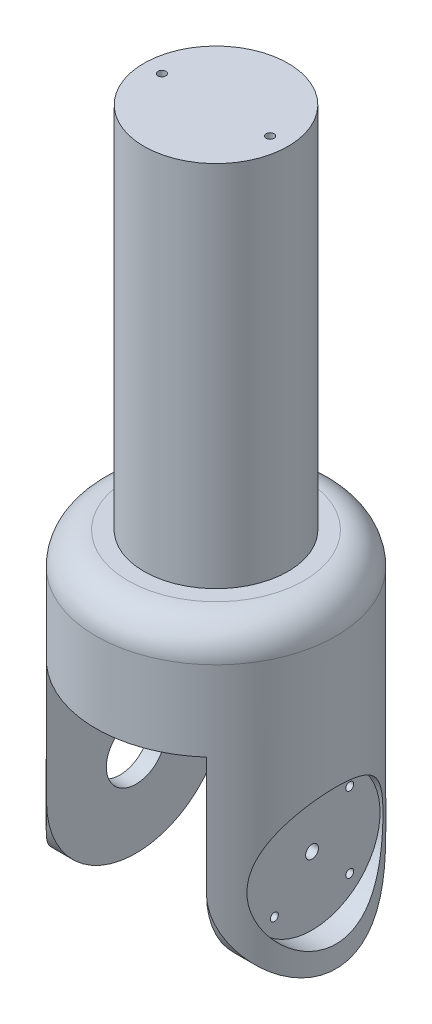
from build123d import *

# Parameters (mm, degrees)
SKETCH1_R               = 75
BOSS_EXTRUDE1_DEPTH     = 200
CUT_EXTRUDE1_DEPTH      = 130
SKETCH3_R               = 45
BOSS_EXTRUDE2_DEPTH     = 230
FILLET2_R               = 20
CUT_EXTRUDE2_DEPTH      = 230
CUT_EXTRUDE2_DEPTH_BACK = 230
CUT_EXTRUDE3_START      = -10
SKETCH5_R               = 42.5
CUT_EXTRUDE3_DEPTH      = 20
CUT_EXTRUDE4_START      = -10
SKETCH6_R               = 40
CUT_EXTRUDE4_DEPTH      = 20
SKETCH7_R               = 16
CUT_EXTRUDE5_DEPTH      = 20
SKETCH8_R               = 4
CUT_EXTRUDE6_DEPTH      = 20
SKETCH9_R               = 18.5
CUT_EXTRUDE7_DEPTH      = 40
SKETCH10_R              = 2.5
CUT_EXTRUDE8_DEPTH      = 40
SKETCH11_R              = 2.5
CUT_EXTRUDE9_DEPTH      = 40


with BuildPart() as part:
    # Sketch1 → Boss-Extrude1 (new body)
    with BuildSketch(Plane(origin=(0, 0, 0), x_dir=(1, 0, 0), z_dir=(0, 1, 0))):
        Circle(SKETCH1_R)
    extrude(amount=BOSS_EXTRUDE1_DEPTH)

    # Sketch2 → Cut-Extrude1 (cut)
    with BuildSketch(Plane.XZ):
        with BuildLine():
            Line((-50, -55.901699437), (-50, 55.901699437))
            ThreePointArc((-50, 55.901699437), (0, 75), (50, 55.901699437))
            Line((50, 55.901699437), (50, -55.901699437))
            ThreePointArc((50, -55.901699437), (0, -75), (-50, -55.901699437))
        make_face()
    extrude(amount=-CUT_EXTRUDE1_DEPTH, mode=Mode.SUBTRACT)

    # Sketch3 → Boss-Extrude2 (add)
    with BuildSketch(Plane(origin=(0, 200, 0), x_dir=(1, 0, 0), z_dir=(0, 1, 0))):
        Circle(SKETCH3_R)
    extrude(amount=BOSS_EXTRUDE2_DEPTH)

    # Fillet2
    fillet2_edges = [part.edges().sort_by_distance(p)[0] for p in [
        (-75, 200, 0),
    ]]
    fillet(fillet2_edges, radius=FILLET2_R)

    # Sketch4 → Cut-Extrude2 (cut, two sides: drawn at the far end of the back side and taken through both)
    with BuildSketch(Plane.ZY.offset(-50).offset(-CUT_EXTRUDE2_DEPTH_BACK)):
        with BuildLine():
            Line((-55.901699437, 55.901699437), (-55.901699437, 0))
            Line((-55.901699437, 0), (9.3e-08, 0))
            ThreePointArc((9.3e-08, 0), (-39.528470719, 16.373228653), (-55.901699437, 55.901699437))
        make_face()
        with BuildLine():
            ThreePointArc((55.901699437, 55.901699437), (39.528470785, 16.373228718), (9.3e-08, 0))
            Line((9.3e-08, 0), (55.901699437, 0))
            Line((55.901699437, 0), (55.901699437, 55.901699437))
        make_face()
    extrude(amount=CUT_EXTRUDE2_DEPTH + CUT_EXTRUDE2_DEPTH_BACK, mode=Mode.SUBTRACT)

    # Sketch5 → Cut-Extrude3 (cut)
    with BuildSketch(Plane.ZY.offset(-50).offset(CUT_EXTRUDE3_START)):
        with Locations((0, 55.901699437)):
            Circle(SKETCH5_R)
    extrude(amount=-CUT_EXTRUDE3_DEPTH, mode=Mode.SUBTRACT)

    # Sketch6 → Cut-Extrude4 (cut)
    with BuildSketch(Plane(origin=(-50, 0, 0), x_dir=(0, 0, -1), z_dir=(1, 0, 0)).offset(CUT_EXTRUDE4_START)):
        with Locations((0, 55.901699437)):
            Circle(SKETCH6_R)
    extrude(amount=-CUT_EXTRUDE4_DEPTH, mode=Mode.SUBTRACT)

    # Sketch7 → Cut-Extrude5 (cut)
    with BuildSketch(Plane.ZY.offset(60)):
        with Locations((0, 55.901699437)):
            Circle(SKETCH7_R)
    extrude(amount=-CUT_EXTRUDE5_DEPTH, mode=Mode.SUBTRACT)

    # Sketch8 → Cut-Extrude6 (cut)
    with BuildSketch(Plane(origin=(60, 0, 0), x_dir=(0, 0, -1), z_dir=(1, 0, 0))):
        with Locations((0, 55.901699438)):
            Circle(SKETCH8_R)
    extrude(amount=-CUT_EXTRUDE6_DEPTH, mode=Mode.SUBTRACT)

    # Sketch9 → Cut-Extrude7 (cut)
    with BuildSketch(Plane.ZY.offset(60)):
        with Locations((0, 55.901699438)):
            Circle(SKETCH9_R)
    extrude(amount=-CUT_EXTRUDE7_DEPTH, mode=Mode.SUBTRACT)

    # Sketch10 → Cut-Extrude8 (cut)
    with BuildSketch(Plane(origin=(60, 0, 0), x_dir=(0, 0, -1), z_dir=(1, 0, 0))):
        with Locations((-23.55, 32.351699437)):
            Circle(SKETCH10_R)
        with Locations((23.55, 32.351699437)):
            Circle(SKETCH10_R)
        with Locations((23.55, 79.451699437)):
            Circle(SKETCH10_R)
        with Locations((-23.55, 79.451699437)):
            Circle(SKETCH10_R)
    extrude(amount=-CUT_EXTRUDE8_DEPTH, mode=Mode.SUBTRACT)

    # Sketch11 → Cut-Extrude9 (cut)
    with BuildSketch(Plane(origin=(0, 440, 0), x_dir=(1, 0, 0), z_dir=(0, 1, 0))):
        with Locations((-33.766216589, 0)):
            Circle(SKETCH11_R)
        with Locations((33.766216589, 0)):
            Circle(SKETCH11_R)
    extrude(amount=-CUT_EXTRUDE9_DEPTH, mode=Mode.SUBTRACT)


solid = part.part
